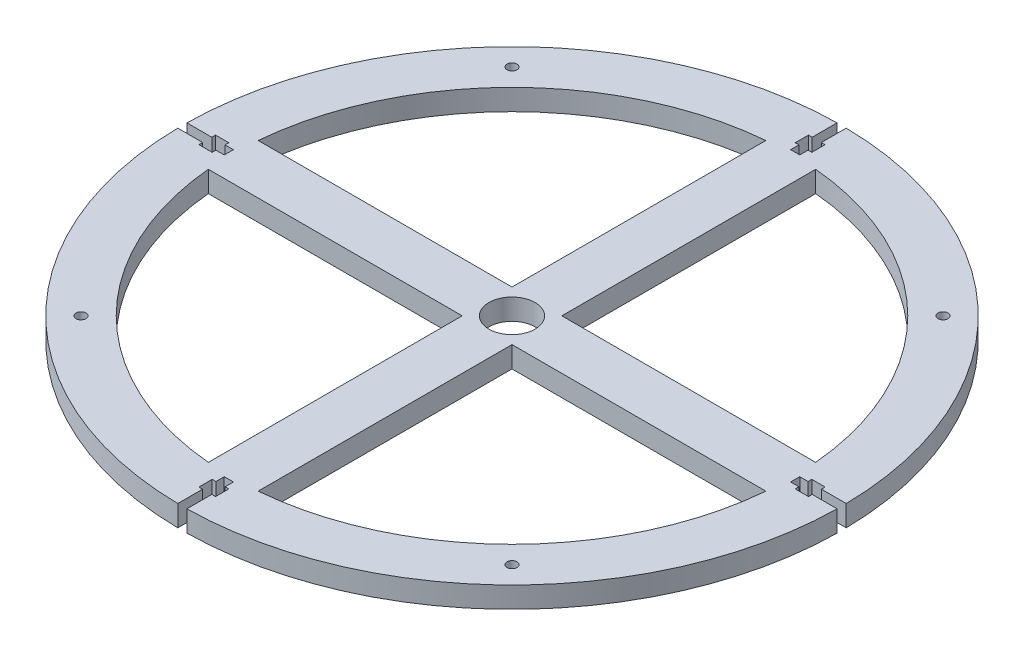
from build123d import *

# Parameters (mm, degrees)
SKETCH1_W                   = 15
SKETCH1_H                   = 15
BOSS_EXTRUDE1_DEPTH         = 3.175
SKETCH2_W                   = 2.75
SKETCH2_H                   = 2.5
SKETCH2_H_2                 = 4
SKETCH2_W_2                 = 1.125
SKETCH2_H_3                 = 7.5
CUT_EXTRUDE1_DEPTH          = 141.379634965
CIRPATTERN1_COUNT           = 4
F_3_0_3_DIAMETER_HOLE1_D    = 3
F_1_2_CLEARANCE_HOLE1_D     = 13.89126
F_1_2_CLEARANCE_HOLE1_DEPTH = 6.35


with BuildPart() as part:
    # Sketch1 → Boss-Extrude1 (new, symmetric)
    with BuildSketch(Plane(origin=(0, 0, 0), x_dir=(1, 0, 0), z_dir=(0, 1, 0))):
        with BuildLine():
            Line((-83.903460262, -7.5), (-98.95418457, -7.5))
            ThreePointArc((-98.95418457, -7.5), (-70.171862751, -70.171862751), (-7.5, -98.95418457))
            Line((-7.5, -98.95418457), (-7.5, -83.903460262))
            ThreePointArc((-7.5, -83.903460262), (-59.565261034, -59.565261034), (-83.903460262, -7.5))
        make_face()
        with BuildLine():
            ThreePointArc((-98.95418457, 7.5), (-99.238, 0), (-98.95418457, -7.5))
            Line((-98.95418457, -7.5), (-83.903460262, -7.5))
            ThreePointArc((-83.903460262, -7.5), (-84.238, 0), (-83.903460262, 7.5))
            Line((-83.903460262, 7.5), (-98.95418457, 7.5))
        make_face()
        with BuildLine():
            Line((83.903460262, -7.5), (98.95418457, -7.5))
            ThreePointArc((98.95418457, -7.5), (99.167020759, -3.752684079), (99.238, 0))
            ThreePointArc((99.238, 0), (99.167020759, 3.752684079), (98.95418457, 7.5))
            Line((98.95418457, 7.5), (83.903460262, 7.5))
            ThreePointArc((83.903460262, 7.5), (84.154323506, 3.753728707), (84.238, 0))
            ThreePointArc((84.238, 0), (84.154323506, -3.753728707), (83.903460262, -7.5))
        make_face()
        with BuildLine():
            ThreePointArc((-7.5, 98.95418457), (-70.171862751, 70.171862751), (-98.95418457, 7.5))
            Line((-98.95418457, 7.5), (-83.903460262, 7.5))
            ThreePointArc((-83.903460262, 7.5), (-59.565261034, 59.565261034), (-7.5, 83.903460262))
            Line((-7.5, 83.903460262), (-7.5, 98.95418457))
        make_face()
        with BuildLine():
            Line((-7.5, -83.903460262), (-7.5, -98.95418457))
            ThreePointArc((-7.5, -98.95418457), (0, -99.238), (7.5, -98.95418457))
            Line((7.5, -98.95418457), (7.5, -83.903460262))
            ThreePointArc((7.5, -83.903460262), (0, -84.238), (-7.5, -83.903460262))
        make_face()
        with BuildLine():
            ThreePointArc((7.5, 98.95418457), (0, 99.238), (-7.5, 98.95418457))
            Line((-7.5, 98.95418457), (-7.5, 83.903460262))
            ThreePointArc((-7.5, 83.903460262), (0, 84.238), (7.5, 83.903460262))
            Line((7.5, 83.903460262), (7.5, 98.95418457))
        make_face()
        with BuildLine():
            ThreePointArc((98.95418457, 7.5), (70.171862751, 70.171862751), (7.5, 98.95418457))
            Line((7.5, 98.95418457), (7.5, 83.903460262))
            ThreePointArc((7.5, 83.903460262), (59.565261034, 59.565261034), (83.903460262, 7.5))
            Line((83.903460262, 7.5), (98.95418457, 7.5))
        make_face()
        with BuildLine():
            Line((7.5, -83.903460262), (7.5, -98.95418457))
            ThreePointArc((7.5, -98.95418457), (70.171862751, -70.171862751), (98.95418457, -7.5))
            Line((98.95418457, -7.5), (83.903460262, -7.5))
            ThreePointArc((83.903460262, -7.5), (59.565261034, -59.565261034), (7.5, -83.903460262))
        make_face()
        with BuildLine():
            Line((7.5, -7.5), (-7.5, -7.5))
            Line((-7.5, -7.5), (-7.5, -83.903460262))
            ThreePointArc((-7.5, -83.903460262), (0, -84.238), (7.5, -83.903460262))
            Line((7.5, -83.903460262), (7.5, -7.5))
        make_face()
        with BuildLine():
            ThreePointArc((-83.903460262, 7.5), (-84.238, 0), (-83.903460262, -7.5))
            Line((-83.903460262, -7.5), (-7.5, -7.5))
            Line((-7.5, -7.5), (-7.5, 7.5))
            Line((-7.5, 7.5), (-83.903460262, 7.5))
        make_face()
        with BuildLine():
            Line((-7.5, 83.903460262), (-7.5, 7.5))
            Line((-7.5, 7.5), (7.5, 7.5))
            Line((7.5, 7.5), (7.5, 83.903460262))
            ThreePointArc((7.5, 83.903460262), (0, 84.238), (-7.5, 83.903460262))
        make_face()
        with BuildLine():
            Line((7.5, 7.5), (7.5, -7.5))
            Line((7.5, -7.5), (83.903460262, -7.5))
            ThreePointArc((83.903460262, -7.5), (84.154323506, -3.753728707), (84.238, 0))
            ThreePointArc((84.238, 0), (84.154323506, 3.753728707), (83.903460262, 7.5))
            Line((83.903460262, 7.5), (7.5, 7.5))
        make_face()
        Rectangle(SKETCH1_W, SKETCH1_H)
    extrude(amount=BOSS_EXTRUDE1_DEPTH, both=True)

    # Sketch2 → Cut-Extrude1 (cut, symmetric)
    with BuildSketch(Plane(origin=(0, 0, 0), x_dir=(1, 0, 0), z_dir=(0, 1, 0))):
        with Locations((0, 86.488)):
            Rectangle(SKETCH2_W, SKETCH2_H)
        with Locations((0, 89.738)):
            Rectangle(SKETCH2_W, SKETCH2_H_2)
        with Locations((1.9375, 89.738)):
            Rectangle(SKETCH2_W_2, SKETCH2_H_2)
        with Locations((0, 95.488)):
            Rectangle(SKETCH2_W, SKETCH2_H_3)
        with Locations((-1.9375, 89.738)):
            Rectangle(SKETCH2_W_2, SKETCH2_H_2)
    cut_extrude1 = extrude(amount=CUT_EXTRUDE1_DEPTH, both=True, mode=Mode.SUBTRACT)

    # CirPattern1: Cut-Extrude1 ×4 about axis
    cirpattern1_axis = Axis((0, 0, 0), (0, 1, 0))
    for i in range(1, CIRPATTERN1_COUNT):
        add(cut_extrude1.rotate(cirpattern1_axis, i * 360 / CIRPATTERN1_COUNT), mode=Mode.SUBTRACT)

    # Ø3.0 (3) Diameter Hole1 (through all)
    with Locations(Plane(origin=(0, 3.175, 0), x_dir=(1, 0, 0), z_dir=(0, 1, 0))):
        with Locations((-64.868561892, -64.868561892), (0, 0), (-64.868561892, 64.868561892), (64.868561892, 64.868561892), (64.868561892, -64.868561892)):
            Hole(F_3_0_3_DIAMETER_HOLE1_D / 2)

    # 1/2 Clearance Hole1
    with Locations(Plane(origin=(0, 3.175, 0), x_dir=(1, 0, 0), z_dir=(0, 1, 0))):
        with Locations((0, 0)):
            Hole(F_1_2_CLEARANCE_HOLE1_D / 2, depth=F_1_2_CLEARANCE_HOLE1_DEPTH)


solid = part.part
